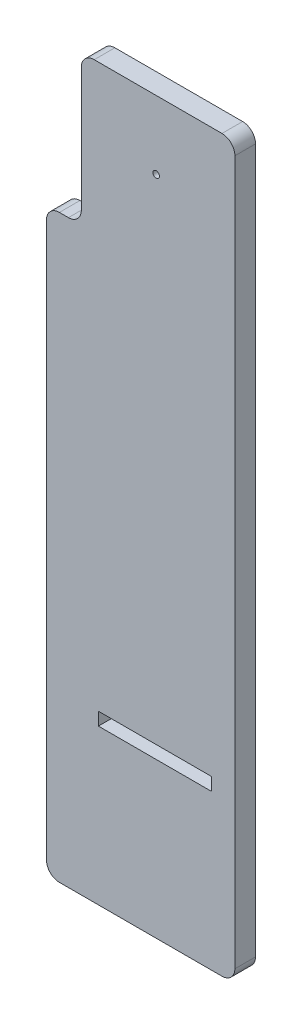
from build123d import *

# Parameters (mm, degrees)
SKETCH_2_W          = 14.6
SKETCH_2_H          = 56.56
SKETCH_2_R          = 0.25
SKETCH_2_W_2        = 8.75
SKETCH_2_H_2        = 1
EXTRUDE_1_DEPTH     = 1.6
SKETCH_3_W          = 2.7
SKETCH_3_H          = 11.6
CUT_EXTRUDE_1_DEPTH = 1.6
FILLET_2_R          = 1


with BuildPart() as part:
    # 草图2 → 凸台-拉伸1 (new body)
    with BuildSketch(Plane.XY):
        with Locations((-0.85, 5.8)):
            Rectangle(SKETCH_2_W, SKETCH_2_H)
        with Locations((0.35, 28.78)):
            Circle(SKETCH_2_R, mode=Mode.SUBTRACT)
        with Locations((0.25, -9.98)):
            Rectangle(SKETCH_2_W_2, SKETCH_2_H_2, mode=Mode.SUBTRACT)
    extrude(amount=EXTRUDE_1_DEPTH)

    # 草图3 → 切除-拉伸1 (cut)
    with BuildSketch(Plane(origin=(0, 0, 0), x_dir=(-1, 0, 0), z_dir=(0, 0, -1))):
        with Locations((6.8, 28.28)):
            Rectangle(SKETCH_3_W, SKETCH_3_H)
    extrude(amount=-CUT_EXTRUDE_1_DEPTH, mode=Mode.SUBTRACT)

    # 圆角2
    fillet_2_edges = [part.edges().sort_by_distance(p)[0] for p in [
        (-5.45, 22.48, 0.8),
        (-5.45, 34.08, 0.8),
        (-8.15, 22.48, 0.8),
        (6.45, -22.48, 0.8),
        (-8.15, -22.48, 0.8),
        (6.45, 34.08, 0.8),
    ]]
    fillet(fillet_2_edges, radius=FILLET_2_R)


solid = part.part
